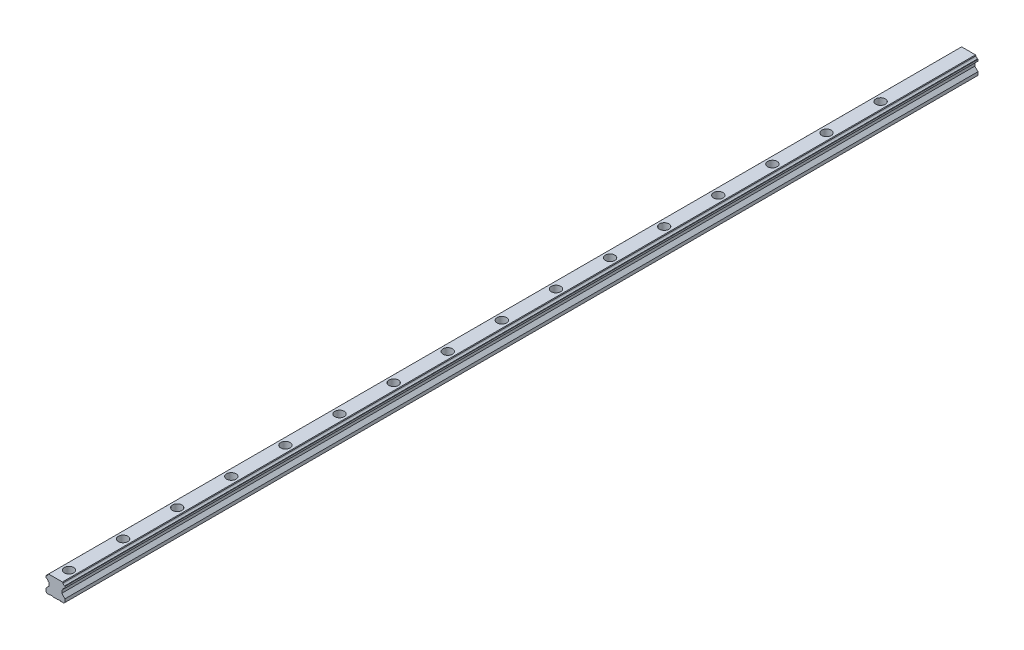
from build123d import *

# Parameters (mm, degrees)
EXTRUDE1_DEPTH  = 1350
LPATTERN1_COUNT = 16
LPATTERN1_PITCH = 80


with BuildPart() as part:
    # Sketch1 → Extrude1 (new body)
    with BuildSketch(Plane(origin=(-20, 0, 0), x_dir=(1, 0, 0), z_dir=(0, 0, 1))):
        with BuildLine():
            Line((6, 22.215003013), (6, 19.779148101))
            Line((6, 19.779148101), (6.469129189, 19.31001796))
            ThreePointArc((6.469129189, 19.31001796), (8.17390926, 18.483479572), (9.000447648, 16.7786995))
            Line((9.000447648, 16.7786995), (10.699707031, 15.079440117))
            Line((10.699707031, 15.079440117), (10.699707031, 10.999628067))
            Line((10.699707031, 10.999628067), (6, 6.3))
            Line((6, 6.3), (6, 1.5))
            Line((6, 1.5), (7.5, 0))
            Line((7.5, 0), (12.25, 0))
            Line((12.25, 0), (12.75, 0.5))
            Line((12.75, 0.5), (16.25, 0.5))
            Line((16.25, 0.5), (16.75, 0))
            Line((16.75, 0), (23.25, 0))
            Line((23.25, 0), (23.75, 0.5))
            Line((23.75, 0.5), (27.25, 0.5))
            Line((27.25, 0.5), (27.75, 0))
            Line((27.75, 0), (32.5, 0))
            Line((32.5, 0), (34, 1.5))
            Line((34, 1.5), (34, 6.3))
            Line((34, 6.3), (29.300292969, 10.999628067))
            Line((29.300292969, 10.999628067), (29.300292969, 15.079440117))
            Line((29.300292969, 15.079440117), (30.999552352, 16.7786995))
            ThreePointArc((30.999552352, 16.7786995), (31.82609074, 18.483479572), (33.530870811, 19.31001796))
            Line((33.530870811, 19.31001796), (34, 19.779148101))
            Line((34, 19.779148101), (34, 22.215003013))
            Line((34, 22.215003013), (33.530870811, 22.690496335))
            ThreePointArc((33.530870811, 22.690496335), (31.828109913, 23.514259322), (30.999552352, 25.214692356))
            Line((30.999552352, 25.214692356), (30.214244708, 26))
            Line((30.214244708, 26), (9.785755292, 26))
            Line((9.785755292, 26), (9.000447648, 25.214692356))
            ThreePointArc((9.000447648, 25.214692356), (8.171890087, 23.514259322), (6.469129189, 22.690496335))
            Line((6.469129189, 22.690496335), (6, 22.215003013))
        make_face()
    extrude(amount=-EXTRUDE1_DEPTH)

    # Sketch2 → Cut-Revolve1 (revolve, cut)
    with BuildSketch(Plane(origin=(0, 0, 0), x_dir=(0, 0, -1), z_dir=(1, 0, 0))):
        Polygon((20, 26), (27, 26), (27, 14), (24.5, 14), (24.5, 0), (20, 0), align=None)
    cut_revolve1 = revolve(axis=Axis((0, 0, -20), (0, 1, 0)), mode=Mode.SUBTRACT)

    # LPattern1: Cut-Revolve1 ×16
    with Locations(*[(0, 0, -i * LPATTERN1_PITCH) for i in range(1, LPATTERN1_COUNT)]):
        add(cut_revolve1, mode=Mode.SUBTRACT)


solid = part.part
